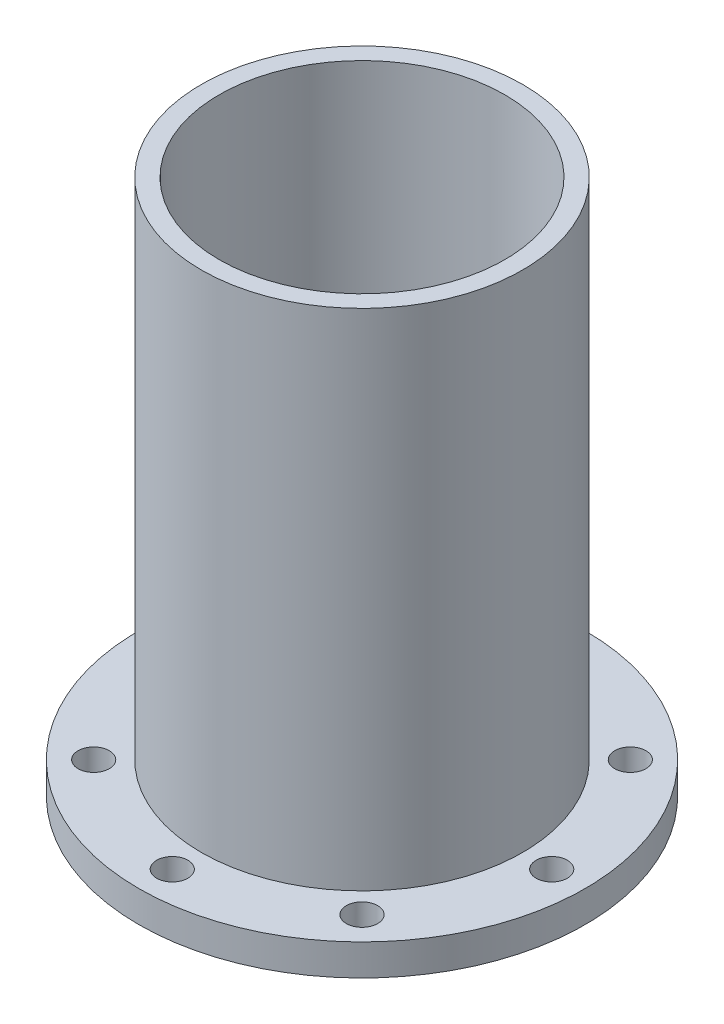
from build123d import *

# Parameters (mm, degrees)
SKETCH2_R          = 1.75
CUT_EXTRUDE1_DEPTH = 10


with BuildPart() as part:
    # Sketch1 → Revolve1 (revolve)
    with BuildSketch(Plane.XY, mode=Mode.PRIVATE) as revolve1_sk:
        Polygon((-18, 30), (-18, -26.5), (-25, -26.5), (-25, -30), (-16, -30), (-16, 30), align=None)
    revolve(revolve1_sk.sketch.rotate(Axis((0, 40.25, 0), (0, -1, 0)), 270), axis=Axis((0, 40.25, 0), (0, -1, 0)))

    # Sketch2 → Cut-Extrude1 (cut)
    with BuildSketch(Plane(origin=(0, -26.5, 0), x_dir=(1, 0, 0), z_dir=(0, 1, 0))):
        with Locations(Location((0, 21.25, 0), (0, 0, 270))):
            Circle(SKETCH2_R)
        with Locations(Location((15.0260191, 15.0260191, 0), (0, 0, 270))):
            Circle(SKETCH2_R)
        with Locations(Location((21.25, 0, 0), (0, 0, 270))):
            Circle(SKETCH2_R)
        with Locations(Location((15.0260191, -15.0260191, 0), (0, 0, 270))):
            Circle(SKETCH2_R)
        with Locations(Location((0, -21.25, 0), (0, 0, 270))):
            Circle(SKETCH2_R)
        with Locations(Location((-15.0260191, -15.0260191, 0), (0, 0, 270))):
            Circle(SKETCH2_R)
        with Locations(Location((-21.25, 0, 0), (0, 0, 270))):
            Circle(SKETCH2_R)
        with Locations(Location((-15.0260191, 15.0260191, 0), (0, 0, 270))):
            Circle(SKETCH2_R)
    extrude(amount=-CUT_EXTRUDE1_DEPTH, mode=Mode.SUBTRACT)


solid = part.part
